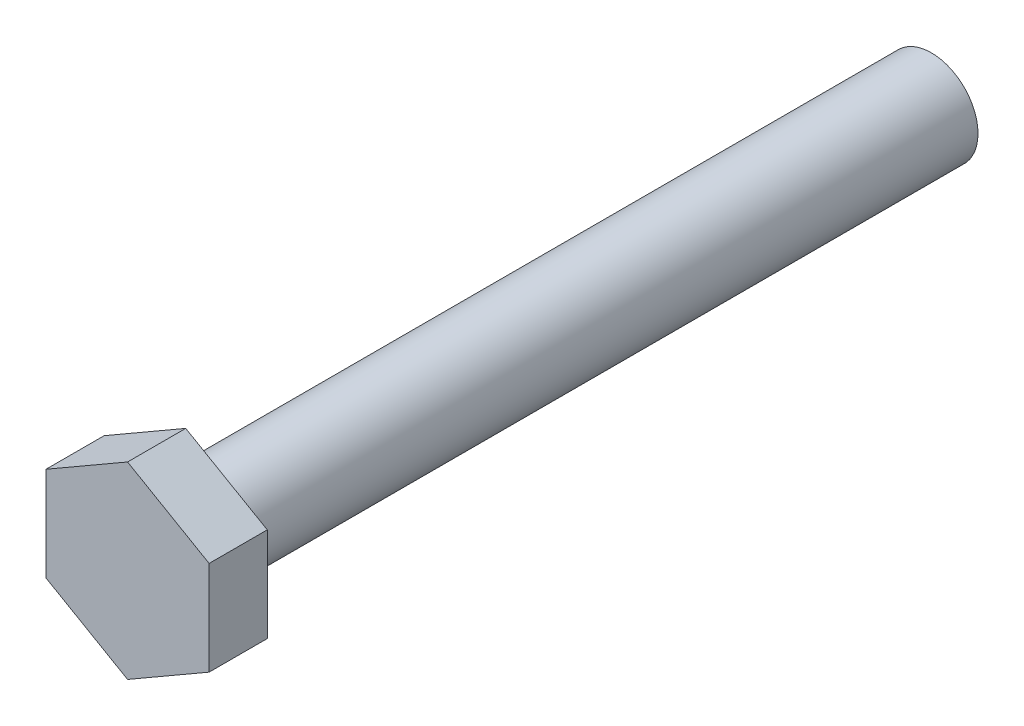
from build123d import *

# Parameters (mm, degrees)
SKETCH1_R           = 3.175
BOSS_EXTRUDE1_DEPTH = 50.8
BOSS_EXTRUDE2_DEPTH = 3.9624


with BuildPart() as part:
    # Sketch1 → Boss-Extrude1 (new body)
    with BuildSketch(Plane.XY):
        Circle(SKETCH1_R)
    extrude(amount=BOSS_EXTRUDE1_DEPTH)

    # Sketch2 → Boss-Extrude2 (add)
    with BuildSketch(Plane.XY.offset(50.8)):
        Polygon((5.55625, 3.207902433), (0, 6.415804866), (-5.55625, 3.207902433), (-5.55625, -3.207902433), (0, -6.415804866), (5.55625, -3.207902433), align=None)
    extrude(amount=BOSS_EXTRUDE2_DEPTH)


solid = part.part
